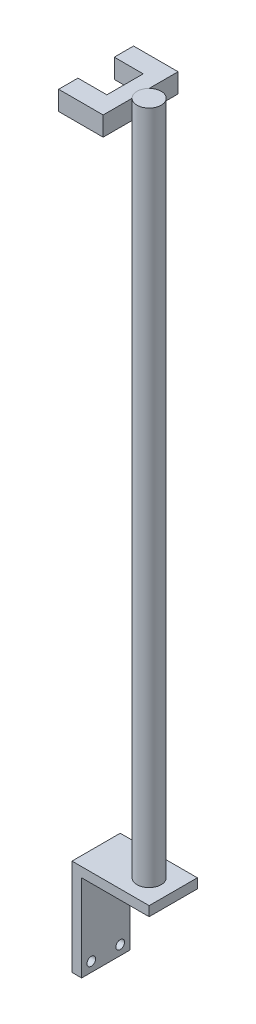
from build123d import *

# Parameters (mm, degrees)
SZKIC1_W                    = 50
SZKIC1_H                    = 100
SZKIC1_R                    = 4.5
DODANIE_WYCI_GNI_CIE1_DEPTH = 10
SZKIC2_W                    = 80
SZKIC2_H                    = 10
DODANIE_WYCI_GNI_CIE2_DEPTH = 50
SZKIC3_R                    = 12.5
DODANIE_WYCI_GNI_CIE3_DEPTH = 700
DODANIE_WYCI_GNI_CIE4_DEPTH = 20


with BuildPart() as part:
    # Szkic1 → Dodanie-wyciągnięcie1 (new body)
    with BuildSketch(Plane(origin=(0, 0, 0), x_dir=(0, 0, -1), z_dir=(1, 0, 0))):
        with Locations((25, 50)):
            Rectangle(SZKIC1_W, SZKIC1_H)
        with Locations((10, 10)):
            Circle(SZKIC1_R, mode=Mode.SUBTRACT)
        with Locations((40, 10)):
            Circle(SZKIC1_R, mode=Mode.SUBTRACT)
    extrude(amount=DODANIE_WYCI_GNI_CIE1_DEPTH)

    # Szkic2 → Dodanie-wyciągnięcie2 (add)
    with BuildSketch(Plane(origin=(0, 0, -50), x_dir=(-1, 0, 0), z_dir=(0, 0, -1))):
        with Locations((-40, 95)):
            Rectangle(SZKIC2_W, SZKIC2_H)
    extrude(amount=-DODANIE_WYCI_GNI_CIE2_DEPTH)

    # Szkic3 → Dodanie-wyciągnięcie3 (add)
    with BuildSketch(Plane(origin=(0, 100, 0), x_dir=(1, 0, 0), z_dir=(0, 1, 0))):
        with Locations(Location((55, 25, 0), (0, 0, 270))):
            Circle(SZKIC3_R)
    extrude(amount=DODANIE_WYCI_GNI_CIE3_DEPTH)


with BuildPart() as body_2:
    # Szkic4 → Dodanie-wyciągnięcie4 (new body)
    with BuildSketch(Plane(origin=(0, 800, 0), x_dir=(1, 0, 0), z_dir=(0, 1, 0))):
        with BuildLine():
            Line((46.161165235, -13.838834765), (46.161165235, 16.161165235))
            ThreePointArc((46.161165235, 16.161165235), (42.5, 25), (46.161165235, 33.838834765))
            Line((46.161165235, 33.838834765), (46.161165235, 63.838834765))
            Line((46.161165235, 63.838834765), (0, 63.838834765))
            Line((0, 63.838834765), (0, 43.838834765))
            Line((0, 43.838834765), (30, 43.838834765))
            Line((30, 43.838834765), (30, 6.161165235))
            Line((30, 6.161165235), (0, 6.161165235))
            Line((0, 6.161165235), (0, -13.838834765))
            Line((0, -13.838834765), (46.161165235, -13.838834765))
        make_face()
    extrude(amount=-DODANIE_WYCI_GNI_CIE4_DEPTH)


solid = Compound([part.part, body_2.part])
